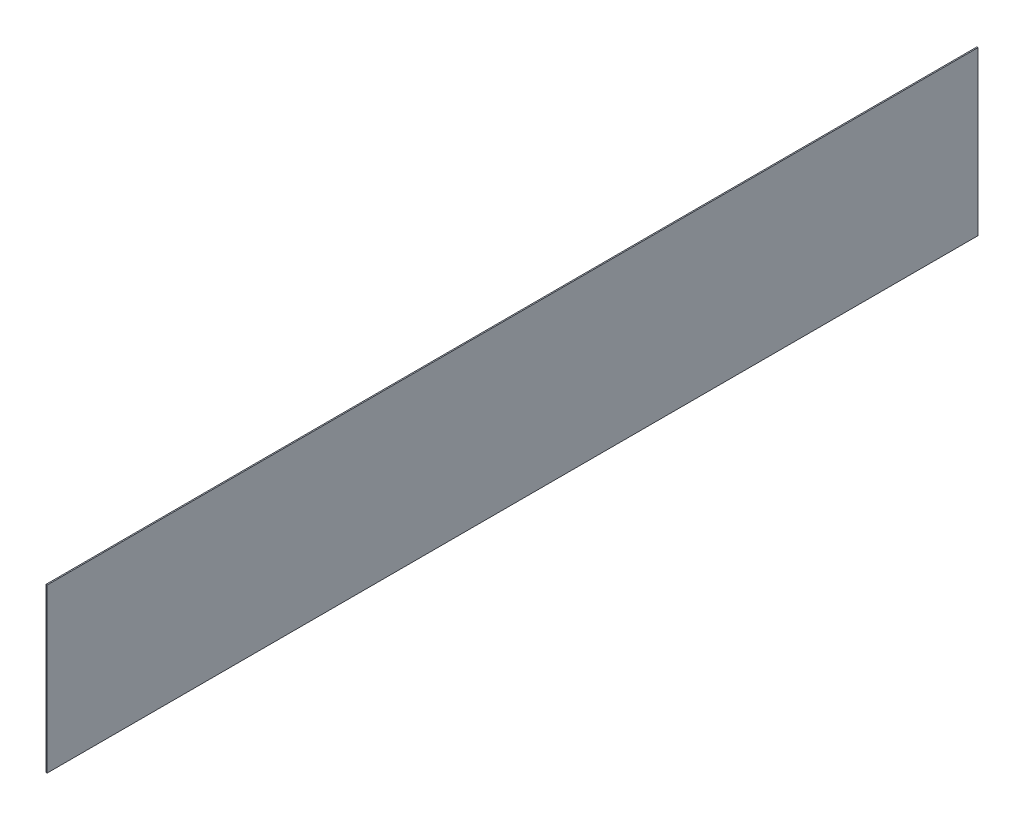
from build123d import *

# Parameters (mm, degrees)
SKETCH1_W           = 8000
SKETCH1_H           = 1400
BOSS_EXTRUDE1_DEPTH = 10


with BuildPart() as part:
    # Sketch1 → Boss-Extrude1 (new body)
    with BuildSketch(Plane(origin=(0, 0, 0), x_dir=(0, 0, -1), z_dir=(1, 0, 0))):
        Rectangle(SKETCH1_W, SKETCH1_H)
    extrude(amount=BOSS_EXTRUDE1_DEPTH)


solid = part.part
